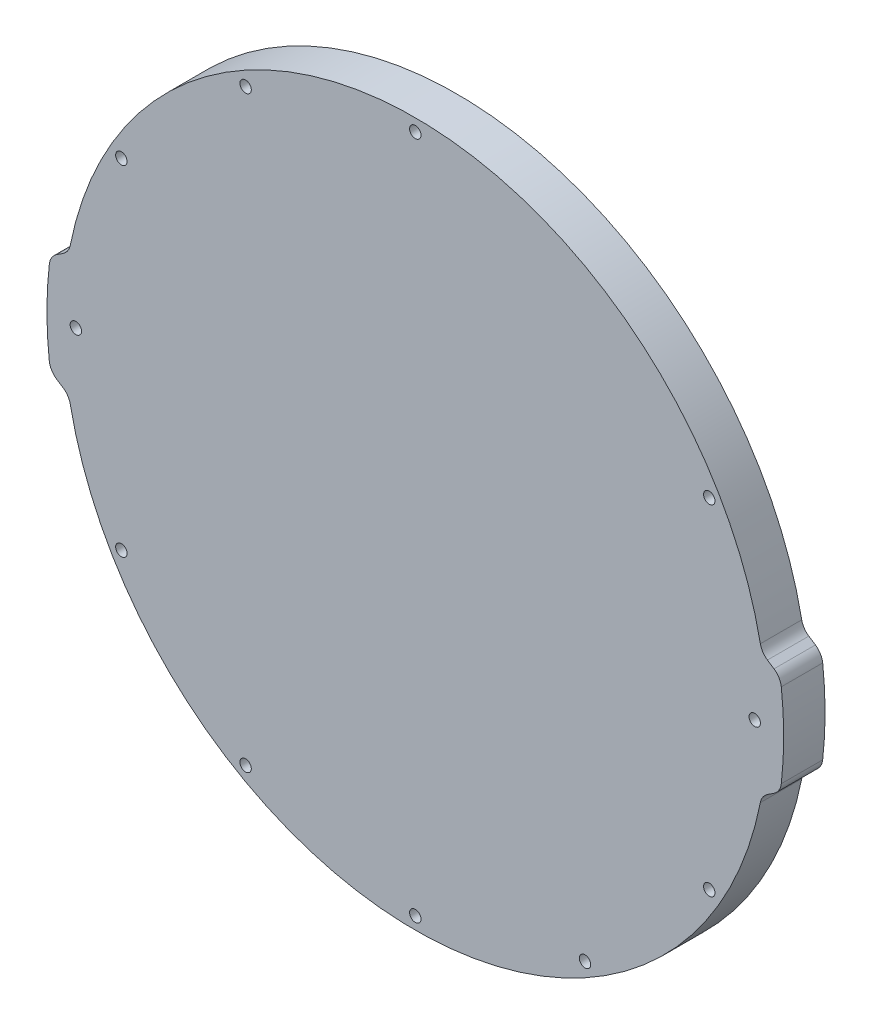
from build123d import *

# Parameters (mm, degrees)
SKETCH1_R           = 1.75
BOSS_EXTRUDE1_DEPTH = 6.35
FILLET1_R           = 5.08


with BuildPart() as part:
    # Sketch1 → Boss-Extrude1 (new, symmetric)
    with BuildSketch(Plane.XY):
        with BuildLine():
            Line((-111.997871855, 15.24), (-106.25582337, 19.05))
            ThreePointArc((-106.25582337, 19.05), (0, 107.95), (106.25582337, 19.05))
            Line((106.25582337, 19.05), (111.997871855, 15.24))
            ThreePointArc((111.997871855, 15.24), (113.03, 0), (111.997871855, -15.24))
            Line((111.997871855, -15.24), (106.25582337, -19.05))
            ThreePointArc((106.25582337, -19.05), (0, -107.95), (-106.25582337, -19.05))
            Line((-106.25582337, -19.05), (-111.997871855, -15.24))
            ThreePointArc((-111.997871855, -15.24), (-113.03, 0), (-111.997871855, 15.24))
        make_face()
        with Locations((0, 104.14)):
            Circle(SKETCH1_R, mode=Mode.SUBTRACT)
        with Locations((90.18788555, 52.07)):
            Circle(SKETCH1_R, mode=Mode.SUBTRACT)
        with Locations((104.14, 0)):
            Circle(SKETCH1_R, mode=Mode.SUBTRACT)
        with Locations((90.18788555, -52.07)):
            Circle(SKETCH1_R, mode=Mode.SUBTRACT)
        with Locations((52.07, -90.18788555)):
            Circle(SKETCH1_R, mode=Mode.SUBTRACT)
        with Locations((0, -104.14)):
            Circle(SKETCH1_R, mode=Mode.SUBTRACT)
        with Locations((-52.07, -90.18788555)):
            Circle(SKETCH1_R, mode=Mode.SUBTRACT)
        with Locations((-90.18788555, -52.07)):
            Circle(SKETCH1_R, mode=Mode.SUBTRACT)
        with Locations((-104.14, 0)):
            Circle(SKETCH1_R, mode=Mode.SUBTRACT)
        with Locations((-90.18788555, 52.07)):
            Circle(SKETCH1_R, mode=Mode.SUBTRACT)
        with Locations((-52.07, 90.18788555)):
            Circle(SKETCH1_R, mode=Mode.SUBTRACT)
    extrude(amount=BOSS_EXTRUDE1_DEPTH, both=True)

    # Fillet1
    fillet1_edges = [part.edges().sort_by_distance(p)[0] for p in [
        (-111.997871855, -15.24, 0),
        (-111.997871855, 15.24, 0),
        (-106.25582337, 19.05, 0),
        (106.25582337, 19.05, 0),
        (111.997871855, 15.24, 0),
        (111.997871855, -15.24, 0),
        (106.25582337, -19.05, 0),
        (-106.25582337, -19.05, 0),
    ]]
    fillet(fillet1_edges, radius=FILLET1_R)


solid = part.part
